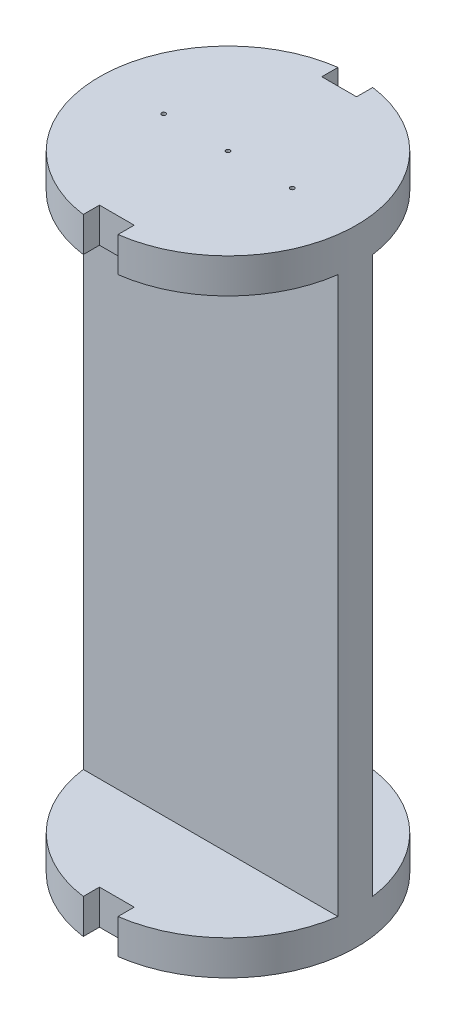
from build123d import *

# Parameters (mm, degrees)
SKETCH1_R           = 37
BOSS_EXTRUDE1_DEPTH = 10
SKETCH2_R           = 37
BOSS_EXTRUDE2_DEPTH = 10
BOSS_EXTRUDE3_REACH = 179.871
SKETCH4_W           = 10
SKETCH4_H           = 10
CUT_EXTRUDE1_DEPTH  = 188.451327016
SKETCH5_R           = 0.6
CUT_EXTRUDE2_DEPTH  = 19.75
SKETCH7_R           = 0.6
CUT_EXTRUDE4_DEPTH  = 19.75


with BuildPart() as part:
    # Sketch1 → Boss-Extrude1 (new body)
    with BuildSketch(Plane(origin=(0, 0, 0), x_dir=(1, 0, 0), z_dir=(0, 1, 0))):
        with Locations(Location((0, 0, 0), (0, 0, 270))):
            Circle(SKETCH1_R)
    extrude(amount=BOSS_EXTRUDE1_DEPTH)


with BuildPart() as body_2:
    # Sketch2 → Boss-Extrude2 (new body)
    with BuildSketch(Plane(origin=(0, 180, 0), x_dir=(1, 0, 0), z_dir=(0, 1, 0))):
        with Locations(Location((0, 0, 0), (0, 0, 270))):
            Circle(SKETCH2_R)
    extrude(amount=-BOSS_EXTRUDE2_DEPTH)

    # Sketch3 → Boss-Extrude3 (add, up to next)
    with BuildSketch(Plane(origin=(0, 10, 0), x_dir=(1, 0, 0), z_dir=(0, 1, 0)), mode=Mode.PRIVATE) as boss_extrude3_sk1:
        with BuildLine():
            Line((36.66060556, 5), (-36.66060556, 5))
            ThreePointArc((-36.66060556, 5), (-37, 0), (-36.66060556, -5))
            Line((-36.66060556, -5), (36.66060556, -5))
            ThreePointArc((36.66060556, -5), (37, 0), (36.66060556, 5))
        make_face()
    boss_extrude3_tool1 = extrude(boss_extrude3_sk1.sketch, amount=BOSS_EXTRUDE3_REACH, mode=Mode.PRIVATE) - body_2.part

    add(part.part)  # Boss-Extrude3 merges part
    add(boss_extrude3_tool1.solids().sort_by_distance((0, 10, 0))[0])

    # Sketch4 → Cut-Extrude1 (cut, through all)
    with BuildSketch(Plane(origin=(0, 180, 0), x_dir=(1, 0, 0), z_dir=(0, 1, 0))):
        with Locations((0, 37)):
            Rectangle(SKETCH4_W, SKETCH4_H)
        with Locations((0, -37)):
            Rectangle(SKETCH4_W, SKETCH4_H)
    extrude(amount=-CUT_EXTRUDE1_DEPTH, mode=Mode.SUBTRACT)

    # Sketch5 → Cut-Extrude2 (cut)
    with BuildSketch(Plane(origin=(0, 180, 0), x_dir=(1, 0, 0), z_dir=(0, 1, 0))):
        with Locations(Location((-18.5, 0, 0), (0, 0, 270))):
            Circle(SKETCH5_R)
        with Locations(Location((0, 0, 0), (0, 0, 270))):
            Circle(SKETCH5_R)
        with Locations(Location((18.5, 0, 0), (0, 0, 270))):
            Circle(SKETCH5_R)
    extrude(amount=-CUT_EXTRUDE2_DEPTH, mode=Mode.SUBTRACT)

    # Sketch7 → Cut-Extrude4 (cut)
    with BuildSketch(Plane.XZ):
        with Locations(Location((-19.25, 0, 0), (0, 0, 270))):
            Circle(SKETCH7_R)
        with Locations(Location((0, 0, 0), (0, 0, 90))):
            Circle(SKETCH7_R)
        with Locations(Location((19.25, 0, 0), (0, 0, 270))):
            Circle(SKETCH7_R)
    extrude(amount=-CUT_EXTRUDE4_DEPTH, mode=Mode.SUBTRACT)


solid = body_2.part
